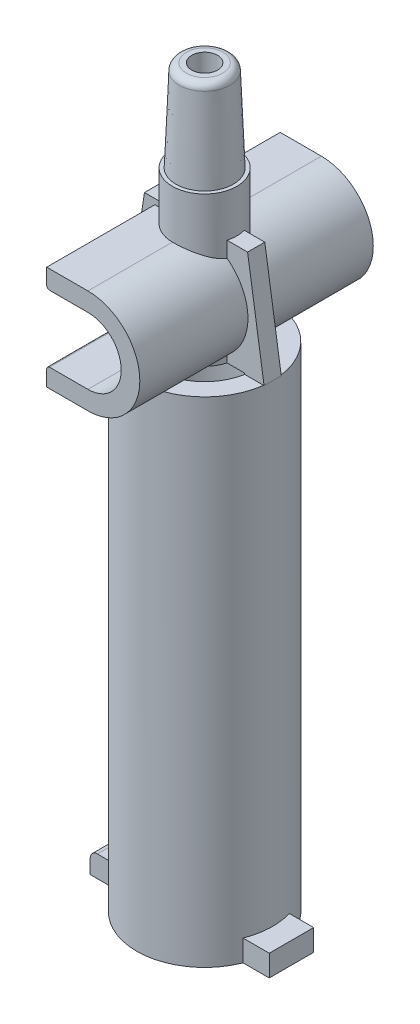
from build123d import *

# Parameters (mm, degrees)
SKETCH1_R                = 4.75
BOSS_EXTRUDE1_DEPTH      = 34.5
BOSS_EXTRUDE3_DEPTH      = 0.6
BOSS_EXTRUDE3_DEPTH_BACK = 0.6
BOSS_EXTRUDE6_DEPTH      = 7.55
CUT_EXTRUDE2_DEPTH       = 7.55
FILLET2_R                = 0.2
FILLET2_OF_MIRROR1_R     = 0.2
SKETCH10_R               = 2.25
BOSS_EXTRUDE7_DEPTH      = 10.5
SKETCH11_R               = 2
SKETCH13_R               = 1.75
BOSS_EXTRUDE8_DEPTH      = 6.25
BOSS_EXTRUDE8_DEPTH_BACK = 6.25
SKETCH14_W               = 3.1
SKETCH14_H               = 1.5
SKETCH15_R               = 3.45
CUT_EXTRUDE3_DEPTH       = 34.58
FILLET3_R                = 0.2
SKETCH16_R               = 0.9
CUT_EXTRUDE4_DEPTH       = 34.58
FILLET4_R                = 0.5


with BuildPart() as part:
    # Sketch1 → Boss-Extrude1 (new body)
    with BuildSketch(Plane(origin=(0, 0, 0), x_dir=(1, 0, 0), z_dir=(0, 1, 0))):
        with Locations(Location((0, 0, 0), (0, 0, 270))):
            Circle(SKETCH1_R)
    extrude(amount=BOSS_EXTRUDE1_DEPTH)

    # Sketch2 → Boss-Extrude3 (add, two sides: drawn at the far end of the back side and taken through both)
    with BuildSketch(Plane.XY.offset(-BOSS_EXTRUDE3_DEPTH_BACK)):
        Polygon((-4.75, 34.5), (-3.6, 42), (3.6, 42), (4.75, 34.5), align=None)
    extrude(amount=BOSS_EXTRUDE3_DEPTH + BOSS_EXTRUDE3_DEPTH_BACK)

    # Sketch6 → Boss-Extrude6 (add)
    with BuildSketch(Plane.XY.offset(0.6)):
        with BuildLine():
            Line((0, 41.625), (-2.875, 41.625))
            Line((-2.875, 41.625), (-2.875, 34.375))
            Line((-2.875, 34.375), (0, 34.375))
            ThreePointArc((0, 34.375), (3.625, 38), (0, 41.625))
        make_face()
    boss_extrude6 = extrude(amount=BOSS_EXTRUDE6_DEPTH)

    # Sketch9 → Cut-Extrude2 (cut)
    with BuildSketch(Plane.XY.offset(8.15)):
        with BuildLine():
            Line((-2.875, 40.325), (0, 40.325))
            ThreePointArc((0, 40.325), (2.325, 38), (0, 35.675))
            Line((0, 35.675), (-2.875, 35.675))
            Line((-2.875, 35.675), (-2.875, 40.325))
        make_face()
    cut_extrude2 = extrude(amount=-CUT_EXTRUDE2_DEPTH, mode=Mode.SUBTRACT)

    # Fillet2
    fillet2_edges = [part.edges().sort_by_distance(p)[0] for p in [
        (-2.875, 35.675, 4.375),
        (-2.875, 40.325, 4.375),
    ]]
    fillet(fillet2_edges, radius=FILLET2_R)

    # Mirror1: Boss-Extrude6, Cut-Extrude2 across plane
    add(boss_extrude6.mirror(Plane.XY))
    add(cut_extrude2.mirror(Plane.XY), mode=Mode.SUBTRACT)

    # Fillet2 of Mirror1
    fillet2_of_mirror1_edges = [part.edges().sort_by_distance(p)[0] for p in [
        (-2.875, 35.675, -4.375),
        (-2.875, 40.325, -4.375),
    ]]
    fillet(fillet2_of_mirror1_edges, radius=FILLET2_OF_MIRROR1_R)

    # Sketch10 → Boss-Extrude7 (add)
    with BuildSketch(Plane(origin=(0, 34.5, 0), x_dir=(1, 0, 0), z_dir=(0, 1, 0))):
        with Locations(Location((0, 0, 0), (0, 0, 270))):
            Circle(SKETCH10_R)
    extrude(amount=BOSS_EXTRUDE7_DEPTH)

    # Sketch11 → Loft1 section 0
    with BuildSketch(Plane(origin=(0, 45, 0), x_dir=(1, 0, 0), z_dir=(0, 1, 0))):
        Circle(SKETCH11_R)
    # Sketch13 → Loft1 section 1
    with BuildSketch(Plane(origin=(0, 51.35, 0), x_dir=(1, 0, 0), z_dir=(0, 1, 0))):
        Circle(SKETCH13_R)
    loft()

    # Sketch14 → Boss-Extrude8 (add, two sides: drawn at the far end of the back side and taken through both)
    with BuildSketch(Plane(origin=(0, 0, 0), x_dir=(0, 0, -1), z_dir=(1, 0, 0)).offset(-BOSS_EXTRUDE8_DEPTH_BACK)):
        with Locations((-0.187519855, 0.75)):
            Rectangle(SKETCH14_W, SKETCH14_H)
    extrude(amount=BOSS_EXTRUDE8_DEPTH + BOSS_EXTRUDE8_DEPTH_BACK)

    # Sketch15 → Cut-Extrude3 (cut)
    with BuildSketch(Plane.XZ):
        with Locations(Location((0, 0, 0), (0, 0, 270))):
            Circle(SKETCH15_R)
    extrude(amount=-CUT_EXTRUDE3_DEPTH, mode=Mode.SUBTRACT)

    # Fillet3
    fillet3_edges = [part.edges().sort_by_distance(p)[0] for p in [
        (0, 0, 3.45),
    ]]
    fillet(fillet3_edges, radius=FILLET3_R)

    # Sketch16 → Cut-Extrude4 (cut)
    with BuildSketch(Plane(origin=(0, 51.35, 0), x_dir=(1, 0, 0), z_dir=(0, 1, 0))):
        with Locations(Location((0, 0, 0), (0, 0, 270))):
            Circle(SKETCH16_R)
    extrude(amount=-CUT_EXTRUDE4_DEPTH, mode=Mode.SUBTRACT)

    # Fillet4
    fillet4_edges = [part.edges().sort_by_distance(p)[0] for p in [
        (-1.75, 51.35, 0),
        (-6.25, 1.5, 0.187519855),
    ]]
    fillet(fillet4_edges, radius=FILLET4_R)


solid = part.part
